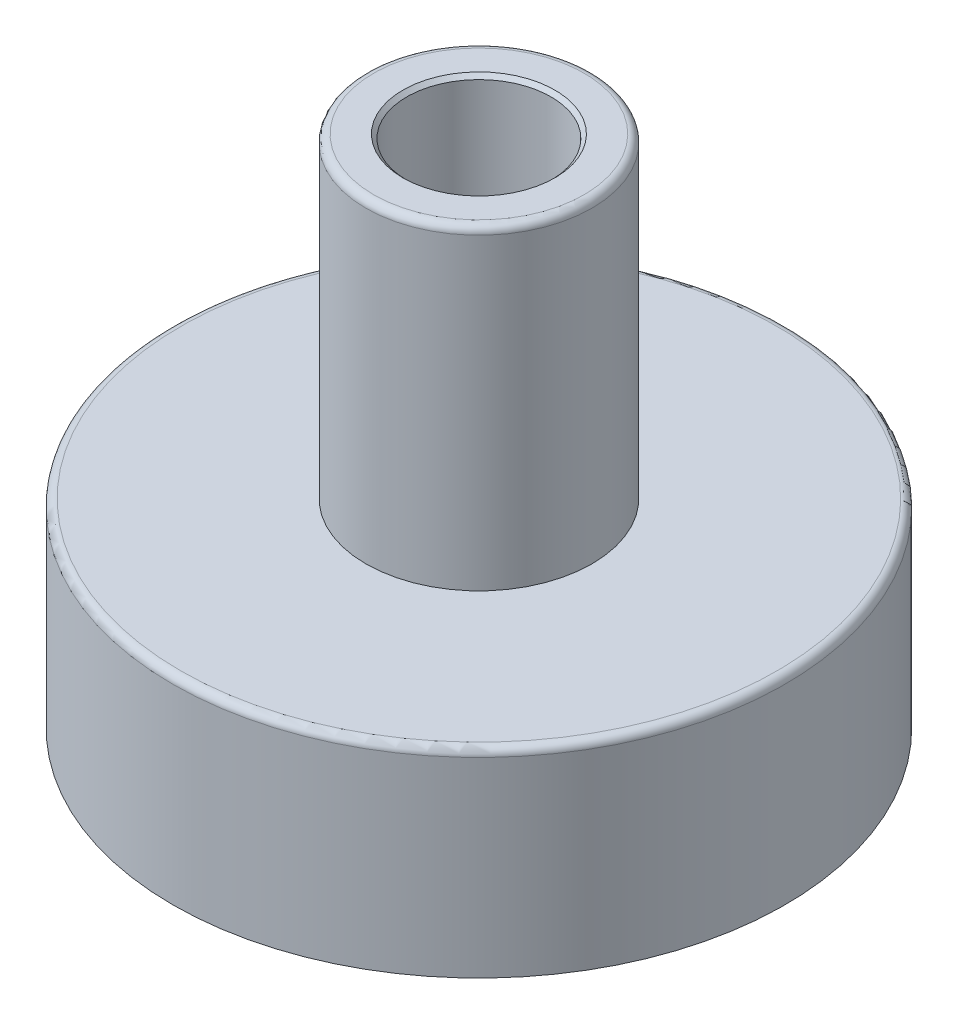
from build123d import *

# Parameters (mm, degrees)
SKETCH1_R           = 7.85
BOSS_EXTRUDE1_DEPTH = 5.1
SKETCH2_R           = 2.9
BOSS_EXTRUDE2_DEPTH = 8.1
SKETCH3_R           = 1.85
CUT_EXTRUDE1_DEPTH  = 7
CHAMFER1_SIZE       = 0.1
FILLET2_R           = 0.2
SKETCH4_R           = 6.25
SKETCH4_R_2         = 6
CUT_EXTRUDE2_DEPTH  = 0.25


with BuildPart() as part:
    # Sketch1 → Boss-Extrude1 (new body)
    with BuildSketch(Plane(origin=(0, 0, 0), x_dir=(1, 0, 0), z_dir=(0, 1, 0))):
        with Locations(Location((0, 0, 0), (0, 0, 270))):
            Circle(SKETCH1_R)
    extrude(amount=-BOSS_EXTRUDE1_DEPTH)

    # Sketch2 → Boss-Extrude2 (add)
    with BuildSketch(Plane(origin=(0, 0, 0), x_dir=(1, 0, 0), z_dir=(0, 1, 0))):
        with Locations(Location((0, 0, 0), (0, 0, 270))):
            Circle(SKETCH2_R)
    extrude(amount=BOSS_EXTRUDE2_DEPTH)

    # Sketch3 → Cut-Extrude1 (cut)
    with BuildSketch(Plane(origin=(0, 8.1, 0), x_dir=(1, 0, 0), z_dir=(0, 1, 0))):
        with Locations(Location((0, 0, 0), (0, 0, 270))):
            Circle(SKETCH3_R)
    extrude(amount=-CUT_EXTRUDE1_DEPTH, mode=Mode.SUBTRACT)

    # Chamfer1
    chamfer1_edges = [part.edges().sort_by_distance(p)[0] for p in [
        (0, 8.1, -1.85),
    ]]
    chamfer(chamfer1_edges, length=CHAMFER1_SIZE)

    # Fillet2
    fillet2_edges = [part.edges().sort_by_distance(p)[0] for p in [
        (0, 0, -7.85),
        (0, 8.1, -2.9),
    ]]
    fillet(fillet2_edges, radius=FILLET2_R)

    # Sketch4 → Cut-Extrude2 (cut)
    with BuildSketch(Plane.XZ.offset(5.1)):
        with Locations(Location((0, 0, 0), (0, 0, 270))):
            Circle(SKETCH4_R)
        with Locations(Location((0, 0, 0), (0, 0, 270))):
            Circle(SKETCH4_R_2, mode=Mode.SUBTRACT)
    extrude(amount=-CUT_EXTRUDE2_DEPTH, mode=Mode.SUBTRACT)


solid = part.part
